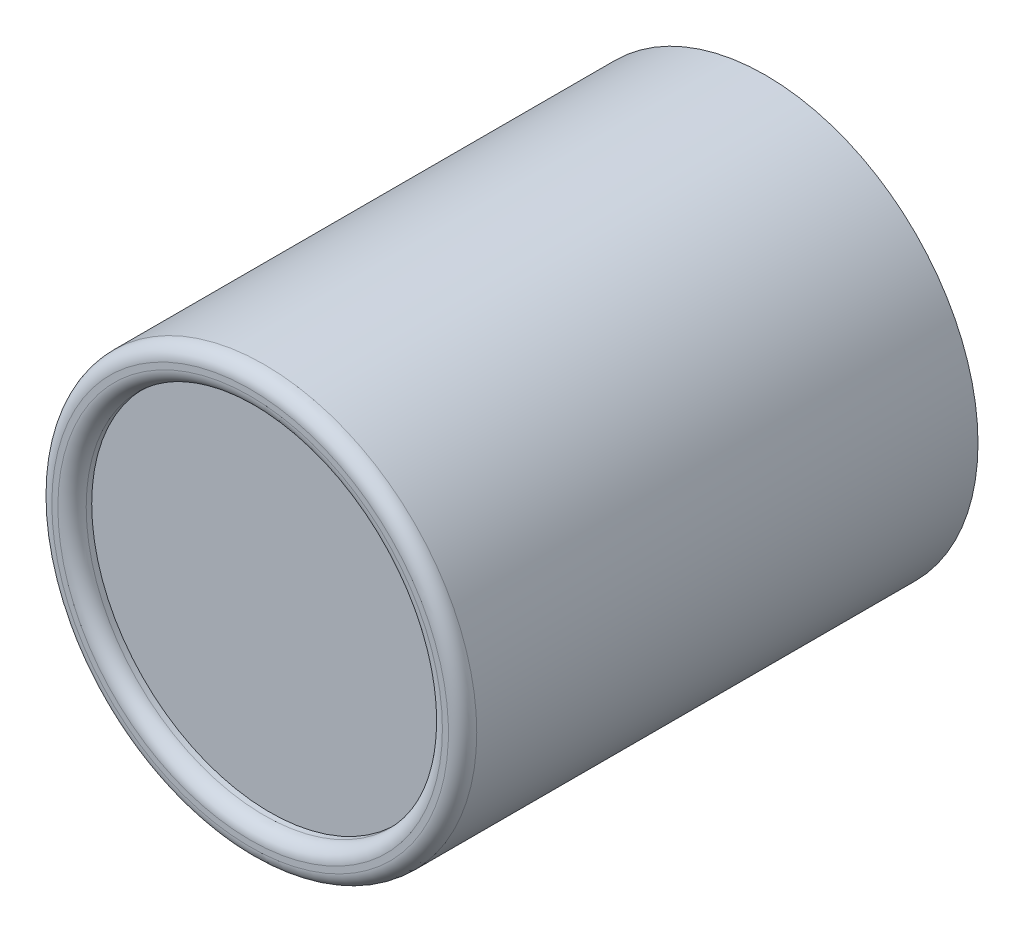
from build123d import *

# Parameters (mm, degrees)
BOSS_EXTRUDE1_START = -1
SKETCH3_R           = 0.75
BOSS_EXTRUDE1_DEPTH = 1


with BuildPart() as part:
    # Sketch2 → Revolve1 (revolve)
    with BuildSketch(Plane(origin=(0, 0, 0), x_dir=(0, 0, -1), z_dir=(1, 0, 0)), mode=Mode.PRIVATE) as revolve1_sk:
        with BuildLine():
            Line((0, 0.75), (0, 0))
            Line((0, 0), (-0.75, 0))
            Line((-0.75, 0), (-0.75, 0.628768743))
            Line((-0.75, 0.628768743), (-0.769458866, 0.628768743))
            ThreePointArc((-0.769458866, 0.628768743), (-0.804814205, 0.643413404), (-0.819458866, 0.678768743))
            Line((-0.819458866, 0.678768743), (-0.819458866, 0.7))
            ThreePointArc((-0.819458866, 0.7), (-0.804814205, 0.735355339), (-0.769458866, 0.75))
            Line((-0.769458866, 0.75), (0, 0.75))
        make_face()
    revolve(revolve1_sk.sketch.rotate(Axis((0, 0, 0), (0, 0, 1)), 90), axis=Axis((0, 0, 0), (0, 0, 1)))

    # Sketch3 → Boss-Extrude1 (add)
    with BuildSketch(Plane.XY.offset(BOSS_EXTRUDE1_START)):
        with Locations(Location((0, 0, 0), (0, 0, 180))):
            Circle(SKETCH3_R)
    extrude(amount=BOSS_EXTRUDE1_DEPTH)


solid = part.part
